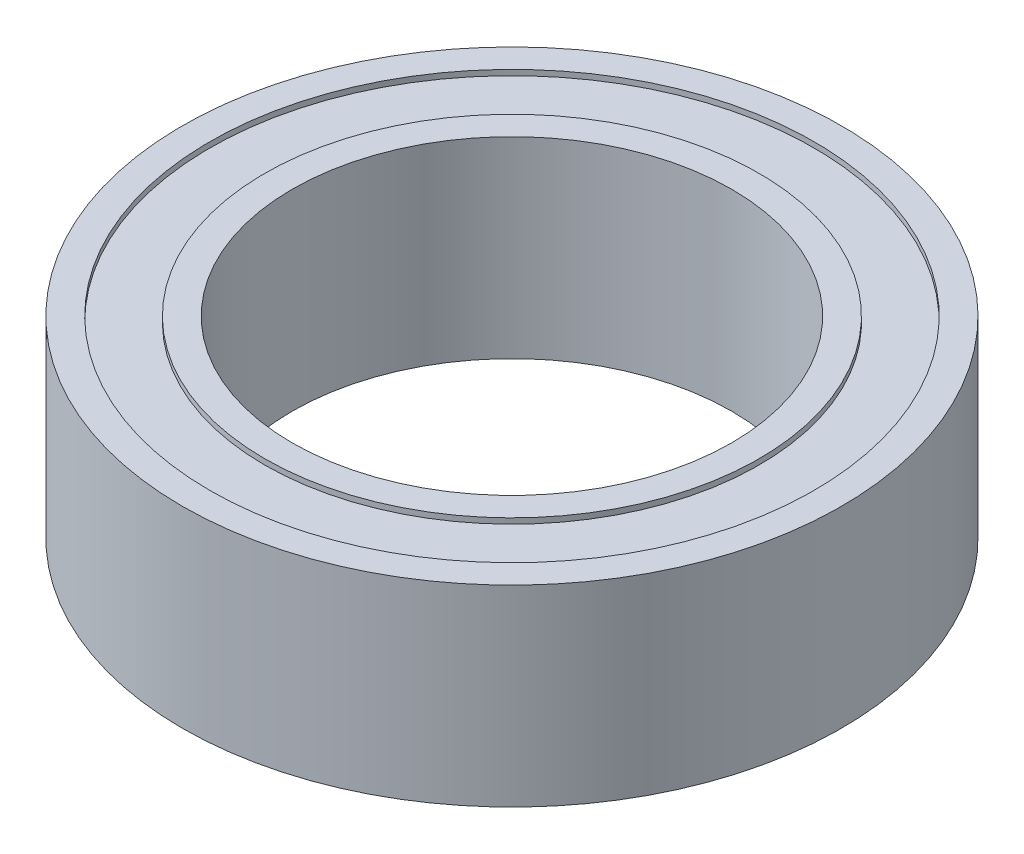
from build123d import *

# Parameters (mm, degrees)
SKETCH_1_R          = 6
EXTRUDE_1_DEPTH     = 3.5
CUT_EXTRUDE_1_REACH = 11.179
SKETCH_2_R          = 4
SKETCH_3_R          = 5.5
SKETCH_3_R_2        = 4.5
CUT_EXTRUDE_2_DEPTH = 0.1
CUT_EXTRUDE_START   = -0.1
SKETCH_4_R          = 5.5
SKETCH_4_R_2        = 4.5
CUT_EXTRUDE_3_DEPTH = 0.1


with BuildPart() as part:
    # 草图1 → 凸台-拉伸1 (new body)
    with BuildSketch(Plane(origin=(0, 0, 0), x_dir=(1, 0, 0), z_dir=(0, 1, 0))):
        with Locations(Location((0, 0, 0), (0, 0, 270))):
            Circle(SKETCH_1_R)
    extrude(amount=EXTRUDE_1_DEPTH)

    # 草图2 → 切除-拉伸1 (cut, up to next)
    with BuildSketch(Plane(origin=(0, 3.5, 0), x_dir=(1, 0, 0), z_dir=(0, 1, 0)), mode=Mode.PRIVATE) as cut_extrude_1_sk1:
        with Locations(Location((0, 0, 0), (0, 0, 270))):
            Circle(SKETCH_2_R)
    cut_extrude_1_tool1 = extrude(cut_extrude_1_sk1.sketch, amount=-CUT_EXTRUDE_1_REACH, mode=Mode.PRIVATE) & part.part
    add(cut_extrude_1_tool1.solids().sort_by_distance((0, 3.5, 0))[0], mode=Mode.SUBTRACT)

    # 草图3 → 切除-拉伸2 (cut)
    with BuildSketch(Plane(origin=(0, 3.5, 0), x_dir=(1, 0, 0), z_dir=(0, 1, 0))):
        with Locations(Location((0, 0, 0), (0, 0, 270))):
            Circle(SKETCH_3_R)
        with Locations(Location((0, 0, 0), (0, 0, 270))):
            Circle(SKETCH_3_R_2, mode=Mode.SUBTRACT)
    extrude(amount=-CUT_EXTRUDE_2_DEPTH, mode=Mode.SUBTRACT)

    # 草图4 → 切除-拉伸3 (cut)
    with BuildSketch(Plane.XZ.offset(CUT_EXTRUDE_START)):
        with Locations(Location((0, 0, 0), (0, 0, 90))):
            Circle(SKETCH_4_R)
        with Locations(Location((0, 0, 0), (0, 0, 90))):
            Circle(SKETCH_4_R_2, mode=Mode.SUBTRACT)
    extrude(amount=CUT_EXTRUDE_3_DEPTH, mode=Mode.SUBTRACT)


solid = part.part
